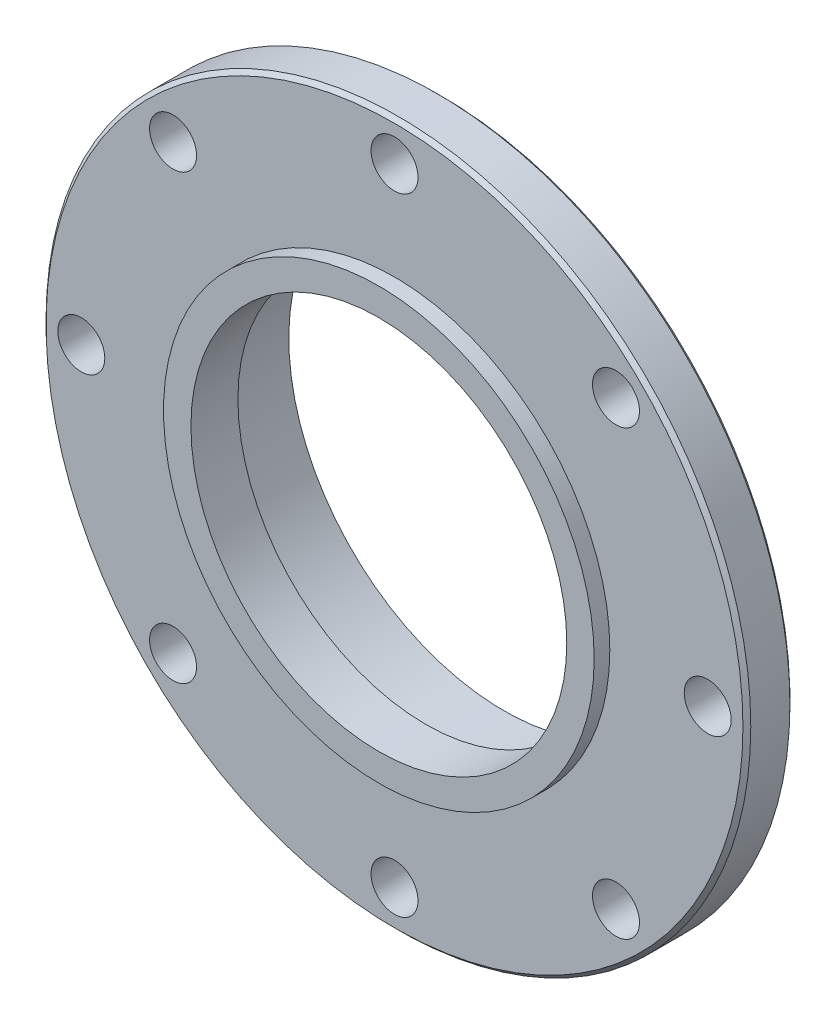
from build123d import *

# Parameters (mm, degrees)
SKETCH_1_R          = 45
EXTRUDE_1_DEPTH     = 14
SKETCH_2_R          = 27.5
EXTRUDE_2_DEPTH     = 2
SKETCH_3_R          = 24
CUT_EXTRUDE_1_DEPTH = 66.620118866
SKETCH_4_R          = 3
CUT_EXTRUDE_2_DEPTH = 15
CHAMFER_1_SIZE      = 0.5
SKETCH_6_R          = 48.016847578
SKETCH_6_R_2        = 30
CUT_EXTRUDE_4_DEPTH = 8
CHAMFER_2_SIZE      = 0.5
SKETCH_7_R          = 27.5
CUT_EXTRUDE_7_DEPTH = 10
FILLET_1_R          = 5


with BuildPart() as part:
    # 草图1 → 拉伸1 (new body)
    with BuildSketch(Plane.XY):
        Circle(SKETCH_1_R)
    extrude(amount=EXTRUDE_1_DEPTH)

    # 草图2 → 拉伸2 (add)
    with BuildSketch(Plane.XY.offset(14)):
        Circle(SKETCH_2_R)
    extrude(amount=EXTRUDE_2_DEPTH)

    # 草图3 → 切除-拉伸1 (cut, through all)
    with BuildSketch(Plane.XY.offset(16)):
        Circle(SKETCH_3_R)
    extrude(amount=-CUT_EXTRUDE_1_DEPTH, mode=Mode.SUBTRACT)

    # 草图4 → 切除-拉伸2 (cut)
    with BuildSketch(Plane(origin=(0, 0, 0), x_dir=(-1, 0, 0), z_dir=(0, 0, -1))):
        with Locations(Location((0, 40, 0), (0, 0, 90))):
            Circle(SKETCH_4_R)
        with Locations(Location((28.284271247, 28.284271247, 0), (0, 0, 90))):
            Circle(SKETCH_4_R)
        with Locations(Location((40, 0, 0), (0, 0, 90))):
            Circle(SKETCH_4_R)
        with Locations(Location((28.284271247, -28.284271247, 0), (0, 0, 90))):
            Circle(SKETCH_4_R)
        with Locations(Location((0, -40, 0), (0, 0, 90))):
            Circle(SKETCH_4_R)
        with Locations(Location((-28.284271247, -28.284271247, 0), (0, 0, 90))):
            Circle(SKETCH_4_R)
        with Locations(Location((-40, 0, 0), (0, 0, 90))):
            Circle(SKETCH_4_R)
        with Locations(Location((-28.284271247, 28.284271247, 0), (0, 0, 90))):
            Circle(SKETCH_4_R)
    extrude(amount=-CUT_EXTRUDE_2_DEPTH, mode=Mode.SUBTRACT)

    # 倒角1
    chamfer_1_edges = [part.edges().sort_by_distance(p)[0] for p in [
        (-45, 0, 0),
        (-45, 0, 14),
    ]]
    chamfer(chamfer_1_edges, length=CHAMFER_1_SIZE)

    # 草图6 → 切除-拉伸4 (cut)
    with BuildSketch(Plane(origin=(0, 0, 0), x_dir=(-1, 0, 0), z_dir=(0, 0, -1))):
        Circle(SKETCH_6_R)
        Circle(SKETCH_6_R_2, mode=Mode.SUBTRACT)
    extrude(amount=-CUT_EXTRUDE_4_DEPTH, mode=Mode.SUBTRACT)

    # 倒角2
    chamfer_2_edges = [part.edges().sort_by_distance(p)[0] for p in [
        (-45, 0, 8),
        (30, 0, 0),
    ]]
    chamfer(chamfer_2_edges, length=CHAMFER_2_SIZE)

    # 草图7 → 切除-拉伸7 (cut)
    with BuildSketch(Plane(origin=(0, 0, 0), x_dir=(-1, 0, 0), z_dir=(0, 0, -1))):
        with Locations(Location((0, 0, 0), (0, 0, 180))):
            Circle(SKETCH_7_R)
    extrude(amount=-CUT_EXTRUDE_7_DEPTH, mode=Mode.SUBTRACT)

    # 圆角1
    fillet_1_edges = [part.edges().sort_by_distance(p)[0] for p in [
        (30, 0, 8),
    ]]
    fillet(fillet_1_edges, radius=FILLET_1_R)


solid = part.part
